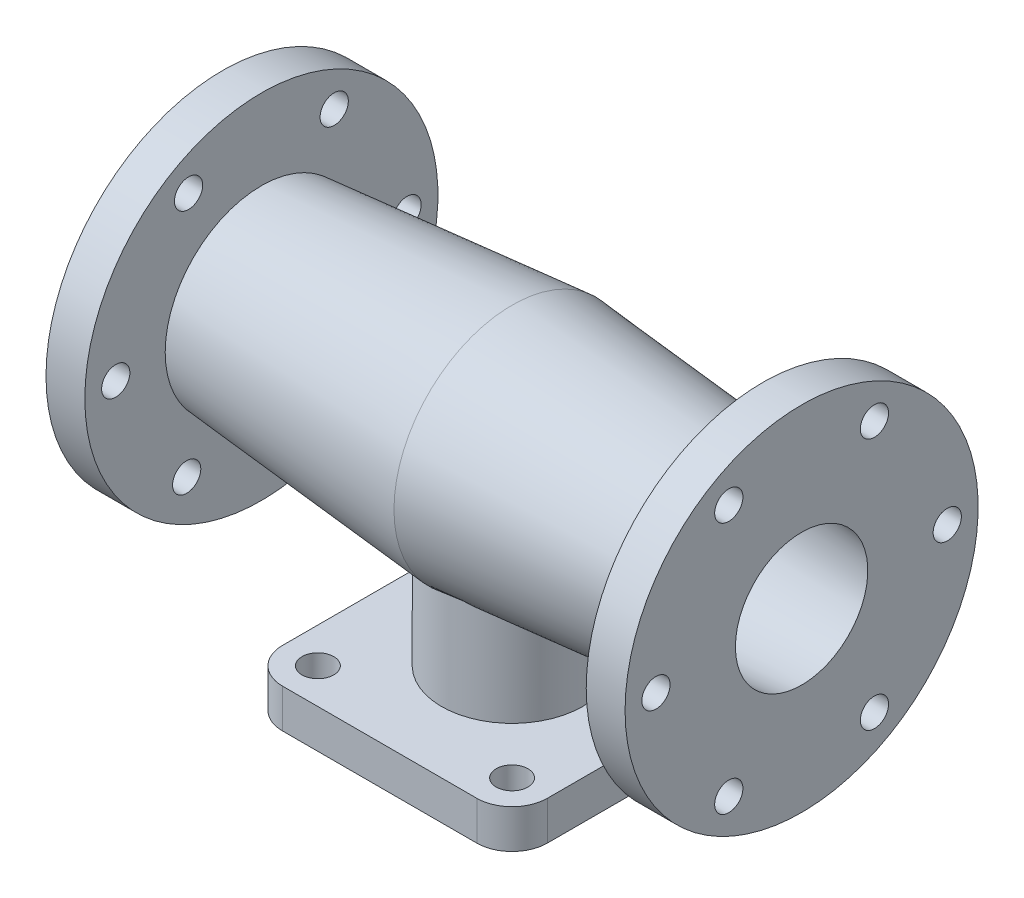
from build123d import *

# Parameters (mm, degrees)
SKETCH3_R                       = 40
SKETCH3_R_2                     = 9
BOSS_EXTRUDE2_DEPTH             = 22
BOSS_EXTRUDE3_REACH             = 286.598
SKETCH3_3_R                     = 40
CUT_EXTRUDE3_DEPTH              = 368.434347967
CUT_EXTRUDE3_DEPTH_BACK         = 368.434347967
SKETCH11_R                      = 8
SKETCH11_4_R                    = 8
CUT_EXTRUDE5_DEPTH              = 22
SKETCH16_W                      = 8
SKETCH16_H                      = 22.001
F_16_0MM_DOWEL_HOLE3_AT_2_COUNT = 2
F_16_0MM_DOWEL_HOLE3_AT_2_PITCH = 79.457440641


with BuildPart() as part:
    # Sketch1 → Revolve1 (revolve)
    with BuildSketch(Plane.XY, mode=Mode.PRIVATE) as revolve1_sk:
        Polygon((-142, -100), (-142, -54.482048161), (0, -66.905438381), (142, -54.482048161), (142, -100), (164, -100), (164, -37.5), (0, -51.848140818), (-164, -37.5), (-164, -100), align=None)
    revolve(revolve1_sk.sketch.rotate(Axis((0, 0, 0), (1, 0, 0)), 270), axis=Axis((0, 0, 0), (1, 0, 0)))

    # Sketch3<3> → Boss-Extrude3 (add, up to next)
    with BuildSketch(Plane(origin=(0, -110, 0), x_dir=(-1, 0, 0), z_dir=(0, -1, 0)), mode=Mode.PRIVATE) as boss_extrude3_sk1:
        with Locations(Location((0, 0, 0), (0, 0, 180))):
            Circle(SKETCH3_3_R)
    boss_extrude3_tool1 = extrude(boss_extrude3_sk1.sketch, amount=-BOSS_EXTRUDE3_REACH, mode=Mode.PRIVATE) - part.part
    add(boss_extrude3_tool1.solids().sort_by_distance((0, -110, 0))[0])

    # Sketch5 → Cut-Revolve4 (revolve, cut)
    with BuildSketch(Plane.XY, mode=Mode.PRIVATE) as cut_revolve4_sk:
        Polygon((-22, -45), (-22, -95), (-27.5, -95), (-27.5, -110), (0, -110), (0, -53.631499), (0, -45), align=None)
    revolve(cut_revolve4_sk.sketch.rotate(Axis((0, 0, 0), (0, -1, 0)), 270), axis=Axis((0, 0, 0), (0, -1, 0)), mode=Mode.SUBTRACT)

    # Sketch11 → Cut-Extrude3 (cut, two sides: drawn at the far end of the back side and taken through both)
    with BuildSketch(Plane(origin=(164, 0, 0), x_dir=(0, 0, -1), z_dir=(1, 0, 0)).offset(-CUT_EXTRUDE3_DEPTH_BACK)):
        with Locations((-41.25, 71.447095812)):
            Circle(SKETCH11_R)
        with Locations((41.25, 71.447095812)):
            Circle(SKETCH11_R)
        with Locations((-82.5, 0)):
            Circle(SKETCH11_R)
        with Locations((82.5, 0)):
            Circle(SKETCH11_R)
    extrude(amount=CUT_EXTRUDE3_DEPTH + CUT_EXTRUDE3_DEPTH_BACK, mode=Mode.SUBTRACT)

    # Sketch11<4> → Cut-Extrude5 (cut)
    with BuildSketch(Plane(origin=(164, 0, 0), x_dir=(0, 0, -1), z_dir=(1, 0, 0))):
        with Locations((-41.25, -71.447095812)):
            Circle(SKETCH11_4_R)
        with Locations((41.25, -71.447095812)):
            Circle(SKETCH11_4_R)
    extrude(amount=-CUT_EXTRUDE5_DEPTH, mode=Mode.SUBTRACT)

    # Sketch16 → Ø16.0mm Dowel Hole3 (revolve, cut)
    with BuildSketch(Plane(origin=(-164, -66.087474409, -37.133817234), x_dir=(0, 0, 1), z_dir=(0, 1, 0))):
        with Locations((4, 11.0005)):
            Rectangle(SKETCH16_W, SKETCH16_H)
    f_16_0mm_dowel_hole3 = revolve(axis=Axis((-170.35, -66.087474409, -37.133817234), (1, 0, 0)), mode=Mode.SUBTRACT)

    # Ø16.0mm Dowel Hole3 at 2: Ø16.0mm Dowel Hole3 ×2
    with Locations(*[Vector(0, -0.014491231834595558, 0.9998949965870997) * (i * F_16_0MM_DOWEL_HOLE3_AT_2_PITCH) for i in range(1, F_16_0MM_DOWEL_HOLE3_AT_2_COUNT)]):
        add(f_16_0mm_dowel_hole3, mode=Mode.SUBTRACT)


with BuildPart() as body_2:
    # Sketch3 → Boss-Extrude2 (new body)
    with BuildSketch(Plane(origin=(0, -110, 0), x_dir=(-1, 0, 0), z_dir=(0, -1, 0))):
        with BuildLine():
            Line((-55, 75), (55, 75))
            ThreePointArc((55, 75), (69.142135624, 69.142135624), (75, 55))
            Line((75, 55), (75, -55))
            ThreePointArc((75, -55), (69.142135624, -69.142135624), (55, -75))
            Line((55, -75), (-55, -75))
            ThreePointArc((-55, -75), (-69.142135624, -69.142135624), (-75, -55))
            Line((-75, -55), (-75, 55))
            ThreePointArc((-75, 55), (-69.142135624, 69.142135624), (-55, 75))
        make_face()
        with Locations(Location((0, 0, 0), (0, 0, 180))):
            Circle(SKETCH3_R, mode=Mode.SUBTRACT)
        with Locations(Location((-55, 55, 0), (0, 0, 180))):
            Circle(SKETCH3_R_2, mode=Mode.SUBTRACT)
        with Locations(Location((-55, -55, 0), (0, 0, 180))):
            Circle(SKETCH3_R_2, mode=Mode.SUBTRACT)
        with Locations(Location((55, -55, 0), (0, 0, 180))):
            Circle(SKETCH3_R_2, mode=Mode.SUBTRACT)
        with Locations(Location((55, 55, 0), (0, 0, 180))):
            Circle(SKETCH3_R_2, mode=Mode.SUBTRACT)
    extrude(amount=BOSS_EXTRUDE2_DEPTH)


solid = Compound([part.part, body_2.part])
